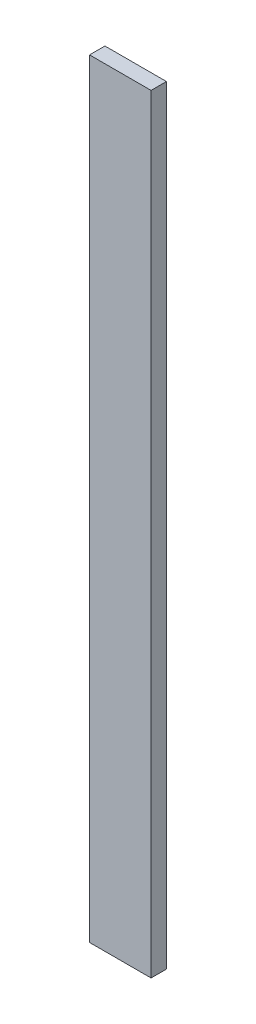
from build123d import *

# Parameters (mm, degrees)
SKETCH1_W           = 25.4
SKETCH1_H           = 317.5
BOSS_EXTRUDE1_DEPTH = 6.35


with BuildPart() as part:
    # Sketch1 → Boss-Extrude1 (new body)
    with BuildSketch(Plane.XY):
        Rectangle(SKETCH1_W, SKETCH1_H)
    extrude(amount=BOSS_EXTRUDE1_DEPTH)


solid = part.part
